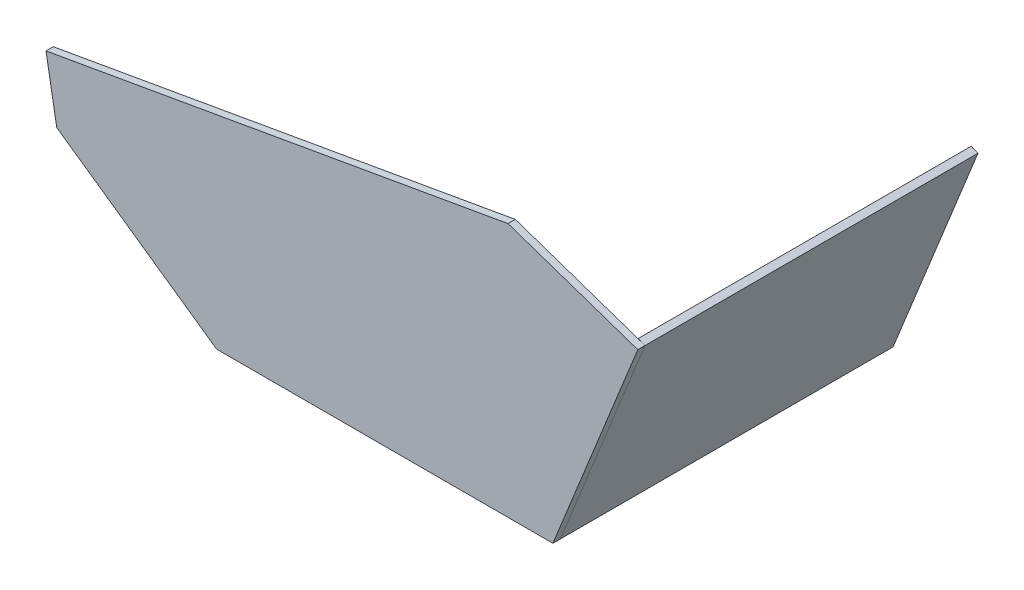
from build123d import *

# Parameters (mm, degrees)
BOSS_EXTRUDE1_DEPTH = 290
BOSS_EXTRUDE2_DEPTH = 6.35


with BuildPart() as part:
    # Sketch1 → Boss-Extrude1 (new body)
    with BuildSketch(Plane.XY):
        Polygon((137.5, 0), (144.348695616, 0), (218.30893616, 183.058019045), (212.421318683, 185.436770913), align=None)
    extrude(amount=BOSS_EXTRUDE1_DEPTH)


with BuildPart() as body_2:
    # Sketch2 → Boss-Extrude2 (new body)
    with BuildSketch(Plane.XY.offset(290)):
        Polygon((-297.202483124, 150.680505869), (105.26641432, 221.646631384), (218.30893616, 183.058019045), (144.348695616, 0), (-148.570887152, 0), (-287.826734681, 97.50799418), align=None)
    extrude(amount=BOSS_EXTRUDE2_DEPTH)


solid = Compound([part.part, body_2.part])
